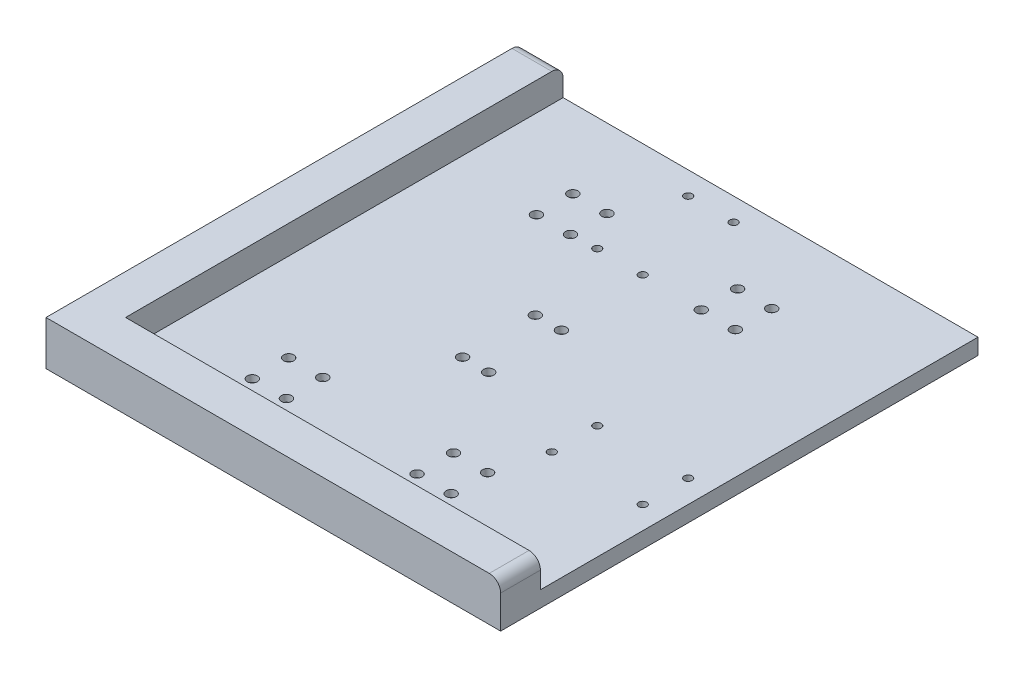
from build123d import *

# Parameters (mm, degrees)
SZKIC1_W                                             = 400
SZKIC1_H                                             = 420
DODANIE_WYCI_GNI_CIE1_DEPTH                          = 14
POG_BIENIE_WALCOWE_POD_M5_WKR_T_DO_CZ_CI_D           = 5.5
POG_BIENIE_WALCOWE_POD_M5_WKR_T_DO_CZ_CI_CBORE_D     = 9
POG_BIENIE_WALCOWE_POD_M5_WKR_T_DO_CZ_CI_CBORE_DEPTH = 6
SZKIC10_W                                            = 70
SZKIC10_H                                            = 4
WYTNIJ_WYCI_GNI_CIE1_DEPTH                           = 50
ZAOKR_GLENIE1_R                                      = 10
SKETCH_1_R                                           = 4.5
CUT_EXTRUDE_1_DEPTH                                  = 6
SKETCH_2_R                                           = 2.75
CUT_EXTRUDE_2_DEPTH                                  = 291.337734372
EXTRUDE_2_DEPTH                                      = 25
FILLET_3_R                                           = 10
FILLET_4_R                                           = 10
SKETCH_5_R                                           = 3.5
CUT_EXTRUDE_3_DEPTH                                  = 292.075591557


with BuildPart() as part:
    # Szkic1 → Dodanie-wyciągnięcie1 (new body)
    with BuildSketch(Plane(origin=(0, 0, 0), x_dir=(1, 0, 0), z_dir=(0, 1, 0))):
        Rectangle(SZKIC1_W, SZKIC1_H)
    extrude(amount=DODANIE_WYCI_GNI_CIE1_DEPTH)

    # Pogłębienie walcowe pod M5 Wkręt do części metalowych z łbem sześciokątnym1 (through all)
    with Locations(Plane(origin=(0, 14, 0), x_dir=(1, 0, 0), z_dir=(0, 1, 0))):
        with Locations((-87.5, -141), (-87.5, -109), (-57.5, -141), (-57.5, -109), (57.5, -141), (57.5, -109), (87.5, -109), (87.5, -141)):
            pog_bienie_walcowe_pod_m5_wkr_t_do_cz_ci = CounterBoreHole(POG_BIENIE_WALCOWE_POD_M5_WKR_T_DO_CZ_CI_D / 2, POG_BIENIE_WALCOWE_POD_M5_WKR_T_DO_CZ_CI_CBORE_D / 2, POG_BIENIE_WALCOWE_POD_M5_WKR_T_DO_CZ_CI_CBORE_DEPTH)

    # Lustro3: Pogłębienie walcowe pod M5 Wkręt do części metalowych z łbem sześciokątnym1 across plane
    add(pog_bienie_walcowe_pod_m5_wkr_t_do_cz_ci.mirror(Plane.XY), mode=Mode.SUBTRACT)

    # Szkic10 → Wytnij-wyciągnięcie1 (cut)
    with BuildSketch(Plane.ZY.offset(200)):
        with Locations((0, 2)):
            Rectangle(SZKIC10_W, SZKIC10_H)
    extrude(amount=-WYTNIJ_WYCI_GNI_CIE1_DEPTH, mode=Mode.SUBTRACT)

    # Zaokrąglenie1
    zaokr_glenie1_edges = [part.edges().sort_by_distance(p)[0] for p in [
        (-150, 2, -35),
        (-150, 2, 35),
    ]]
    fillet(zaokr_glenie1_edges, radius=ZAOKR_GLENIE1_R)

    # 草图1 → 切除-拉伸1 (cut)
    with BuildSketch(Plane(origin=(0, 14, 0), x_dir=(1, 0, 0), z_dir=(0, 1, 0))):
        with Locations(Location((11.5, 32, 0), (0, 0, 270))):
            Circle(SKETCH_1_R)
        with Locations(Location((-11.5, 32, 0), (0, 0, 90))):
            Circle(SKETCH_1_R)
        with Locations(Location((-11.5, -32, 0), (0, 0, 270))):
            Circle(SKETCH_1_R)
        with Locations(Location((11.5, -32, 0), (0, 0, 90))):
            Circle(SKETCH_1_R)
    extrude(amount=-CUT_EXTRUDE_1_DEPTH, mode=Mode.SUBTRACT)

    # 草图2 → 切除-拉伸2 (cut, through all)
    with BuildSketch(Plane(origin=(0, 14, 0), x_dir=(1, 0, 0), z_dir=(0, 1, 0))):
        with Locations(Location((11.5, 32, 0), (0, 0, 270))):
            Circle(SKETCH_2_R)
        with Locations(Location((-11.5, 32, 0), (0, 0, 90))):
            Circle(SKETCH_2_R)
        with Locations(Location((-11.5, -32, 0), (0, 0, 270))):
            Circle(SKETCH_2_R)
        with Locations(Location((11.5, -32, 0), (0, 0, 90))):
            Circle(SKETCH_2_R)
    extrude(amount=-CUT_EXTRUDE_2_DEPTH, mode=Mode.SUBTRACT)

    # 草图4 → 凸台-拉伸2 (add)
    with BuildSketch(Plane(origin=(0, 14, 0), x_dir=(1, 0, 0), z_dir=(0, 1, 0))):
        Polygon((-200, 210), (-200, -210), (200, -210), (200, -175), (-165, -175), (-165, 210), align=None)
    extrude(amount=EXTRUDE_2_DEPTH)

    # 圆角3
    fillet_3_edges = [part.edges().sort_by_distance(p)[0] for p in [
        (200, 39, 192.5),
    ]]
    fillet(fillet_3_edges, radius=FILLET_3_R)

    # 圆角4
    fillet_4_edges = [part.edges().sort_by_distance(p)[0] for p in [
        (-182.5, 39, -210),
    ]]
    fillet(fillet_4_edges, radius=FILLET_4_R)

    # 草图5 → 切除-拉伸3 (cut, through all)
    with BuildSketch(Plane(origin=(0, 14, 0), x_dir=(1, 0, 0), z_dir=(0, 1, 0))):
        with Locations(Location((100, -65, 0), (0, 0, 270))):
            Circle(SKETCH_5_R)
        with Locations(Location((180, -65, 0), (0, 0, 270))):
            Circle(SKETCH_5_R)
        with Locations(Location((180, -25, 0), (0, 0, 90))):
            Circle(SKETCH_5_R)
        with Locations(Location((100, -25, 0), (0, 0, 90))):
            Circle(SKETCH_5_R)
        with Locations(Location((5, 110, 0), (0, 0, 270))):
            Circle(SKETCH_5_R)
        with Locations(Location((5, 190, 0), (0, 0, 270))):
            Circle(SKETCH_5_R)
        with Locations(Location((-35, 190, 0), (0, 0, 90))):
            Circle(SKETCH_5_R)
        with Locations(Location((-35, 110, 0), (0, 0, 90))):
            Circle(SKETCH_5_R)
    extrude(amount=-CUT_EXTRUDE_3_DEPTH, mode=Mode.SUBTRACT)


solid = part.part
